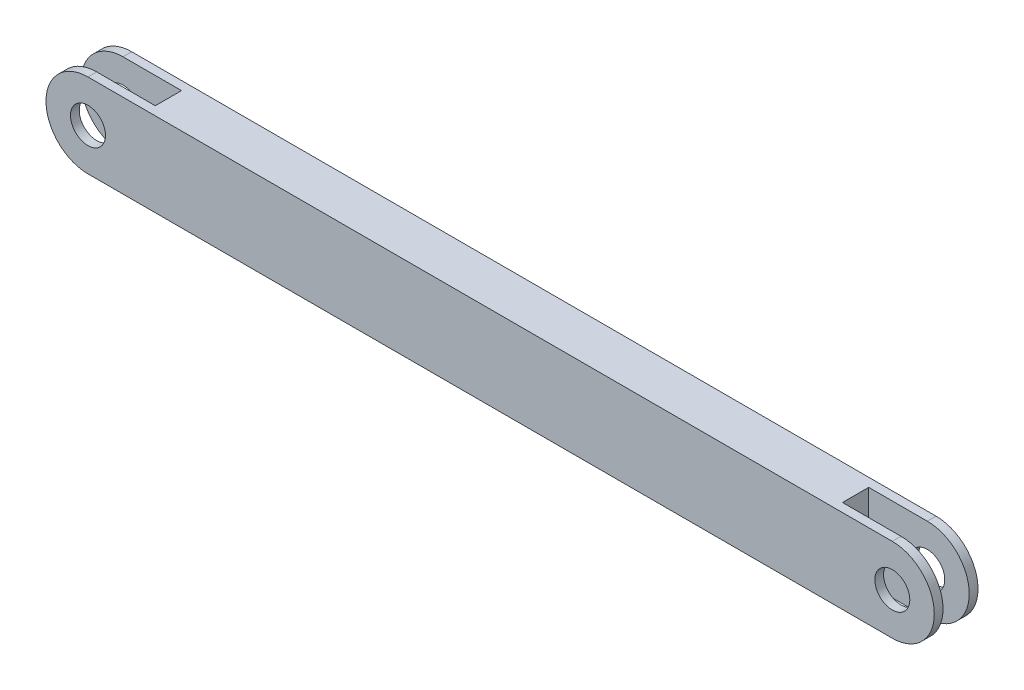
from build123d import *

# Parameters (mm, degrees)
SKETCH1_R               = 10
BOSS_EXTRUDE1_DEPTH     = 25
CUT_EXTRUDE2_DEPTH      = 257.353271873
CUT_EXTRUDE2_DEPTH_BACK = 257.353271873
SKETCH3_W               = 67
SKETCH3_H               = 15


with BuildPart() as part:
    # Sketch1 → Boss-Extrude1 (new body)
    with BuildSketch(Plane.XY):
        with BuildLine():
            Line((-230, 24), (230, 24))
            ThreePointArc((230, 24), (254, 0), (230, -24))
            Line((230, -24), (-230, -24))
            ThreePointArc((-230, -24), (-254, 0), (-230, 24))
        make_face()
        with Locations((-230, 0)):
            Circle(SKETCH1_R, mode=Mode.SUBTRACT)
        with Locations(Location((230, 0, 0), (0, 0, 180))):
            Circle(SKETCH1_R, mode=Mode.SUBTRACT)
    extrude(amount=-BOSS_EXTRUDE1_DEPTH)

    # Sketch3 → Cut-Extrude2 (cut, two sides: drawn at the far end of the back side and taken through both)
    with BuildSketch(Plane(origin=(0, 0, 0), x_dir=(1, 0, 0), z_dir=(0, 1, 0)).offset(-CUT_EXTRUDE2_DEPTH_BACK)):
        with Locations((-230, 12.5)):
            Rectangle(SKETCH3_W, SKETCH3_H)
        with Locations((230, 12.5)):
            Rectangle(SKETCH3_W, SKETCH3_H)
    extrude(amount=CUT_EXTRUDE2_DEPTH + CUT_EXTRUDE2_DEPTH_BACK, mode=Mode.SUBTRACT)


solid = part.part
